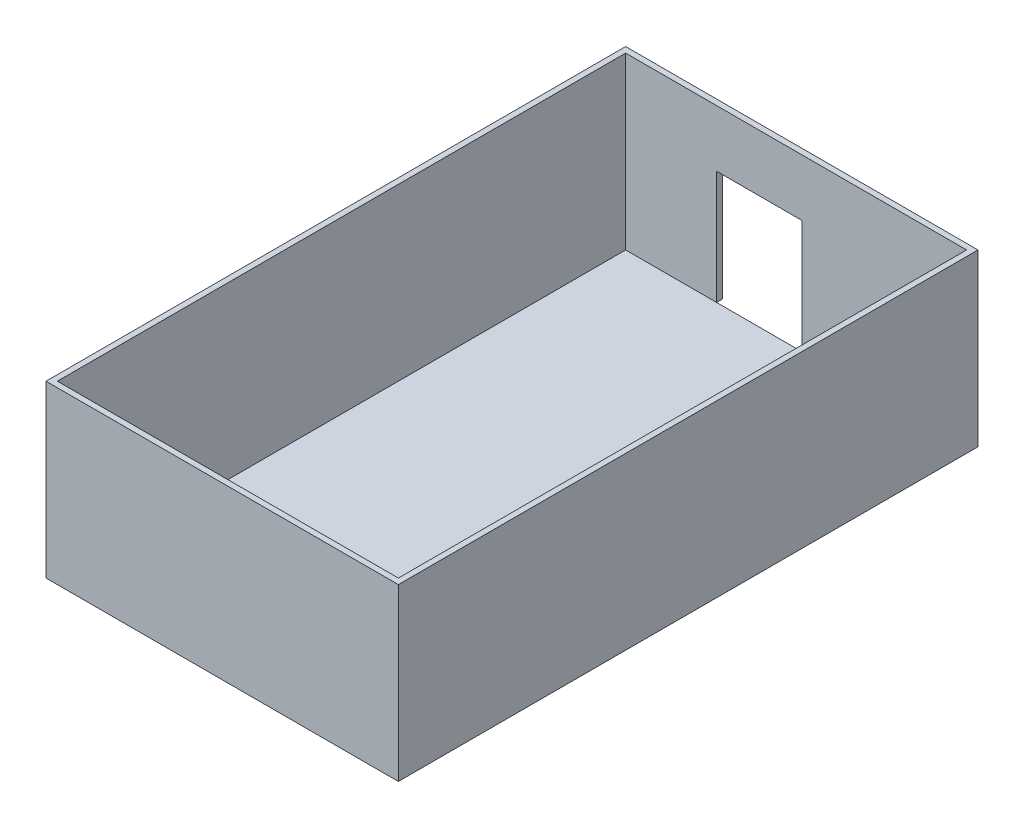
from build123d import *

# Parameters (mm, degrees)
SKETCH1_W           = 6000
SKETCH1_H           = 10000
BOSS_EXTRUDE1_DEPTH = 10
SKETCH3_W           = 6200
SKETCH3_H           = 10200
SKETCH3_W_2         = 6000
SKETCH3_H_2         = 10000
BOSS_EXTRUDE2_DEPTH = 3000
SKETCH4_W           = 1500
SKETCH4_H           = 2000
CUT_EXTRUDE1_DEPTH  = 100


with BuildPart() as part:
    # Sketch1 → Boss-Extrude1 (new body)
    with BuildSketch(Plane(origin=(0, 0, 0), x_dir=(1, 0, 0), z_dir=(0, 1, 0))):
        with Locations((-3000, 5000)):
            Rectangle(SKETCH1_W, SKETCH1_H)
    extrude(amount=BOSS_EXTRUDE1_DEPTH)


with BuildPart() as body_2:
    # Sketch3 → Boss-Extrude2 (new body)
    with BuildSketch(Plane(origin=(0, 10, 0), x_dir=(1, 0, 0), z_dir=(0, 1, 0))):
        with Locations((-3000, 5000)):
            Rectangle(SKETCH3_W, SKETCH3_H)
        with Locations((-3000, 5000)):
            Rectangle(SKETCH3_W_2, SKETCH3_H_2, mode=Mode.SUBTRACT)
    extrude(amount=BOSS_EXTRUDE2_DEPTH)

    # Sketch4 → Cut-Extrude1 (cut)
    with BuildSketch(Plane(origin=(0, 0, -10100), x_dir=(-1, 0, 0), z_dir=(0, 0, -1))):
        with Locations((3650, 1010)):
            Rectangle(SKETCH4_W, SKETCH4_H)
    extrude(amount=-CUT_EXTRUDE1_DEPTH, mode=Mode.SUBTRACT)


solid = Compound([part.part, body_2.part])
